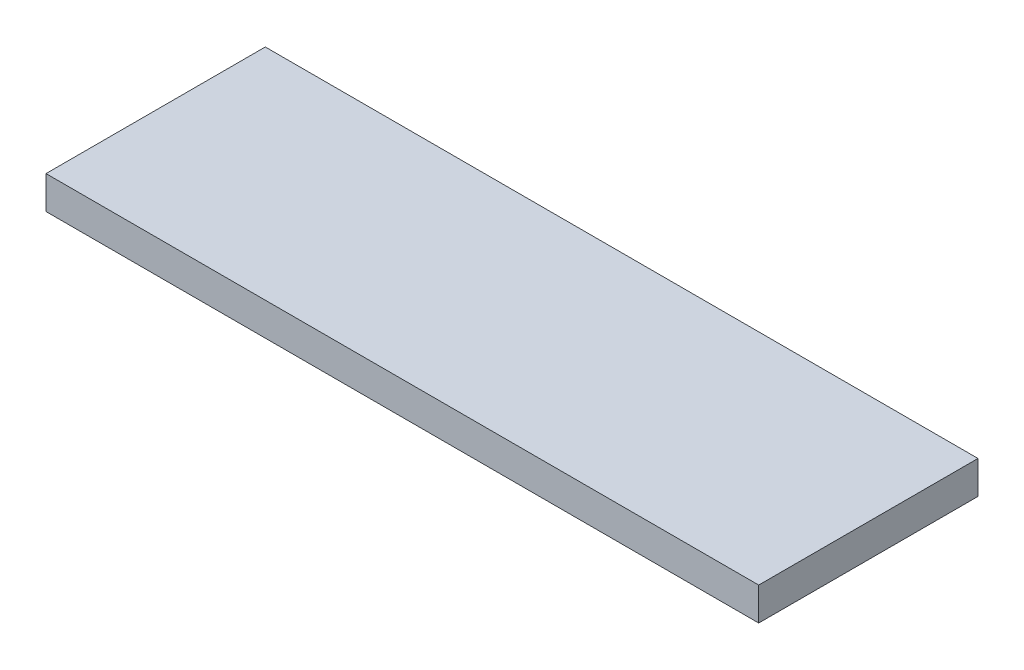
from build123d import *

# Parameters (mm, degrees)
SKETCH1_W           = 130
SKETCH1_H           = 40
BOSS_EXTRUDE1_DEPTH = 6
SKETCH2_W           = 12.3
SKETCH2_H           = 12.3
BOSS_EXTRUDE2_DEPTH = 10
LPATTERN1_COUNT     = 4
LPATTERN1_PITCH     = 30
CHAMFER1_SIZE       = 0.5


with BuildPart() as part:
    # Sketch1 → Boss-Extrude1 (new body)
    with BuildSketch(Plane(origin=(0, 0, 0), x_dir=(1, 0, 0), z_dir=(0, 1, 0))):
        Rectangle(SKETCH1_W, SKETCH1_H)
    extrude(amount=BOSS_EXTRUDE1_DEPTH)

    # Sketch2 → Boss-Extrude2 (add)
    with BuildSketch(Plane.XZ):
        with Locations((-45, 0)):
            Rectangle(SKETCH2_W, SKETCH2_H)
    boss_extrude2 = extrude(amount=BOSS_EXTRUDE2_DEPTH)

    # LPattern1: Boss-Extrude2 ×4
    with Locations(*[(i * LPATTERN1_PITCH, 0, 0) for i in range(1, LPATTERN1_COUNT)]):
        add(boss_extrude2)

    # Chamfer1
    chamfer1_edges = [part.edges().sort_by_distance(p)[0] for p in [
        (-51.15, -10, 0),
        (-45, -10, -6.15),
        (-38.85, -10, 0),
        (-45, -10, 6.15),
        (-21.15, -10, 0),
        (-15, -10, -6.15),
        (-8.85, -10, 0),
        (-15, -10, 6.15),
        (8.85, -10, 0),
        (15, -10, -6.15),
        (21.15, -10, 0),
        (15, -10, 6.15),
        (38.85, -10, 0),
        (45, -10, -6.15),
        (51.15, -10, 0),
        (45, -10, 6.15),
    ]]
    chamfer(chamfer1_edges, length=CHAMFER1_SIZE)


solid = part.part
